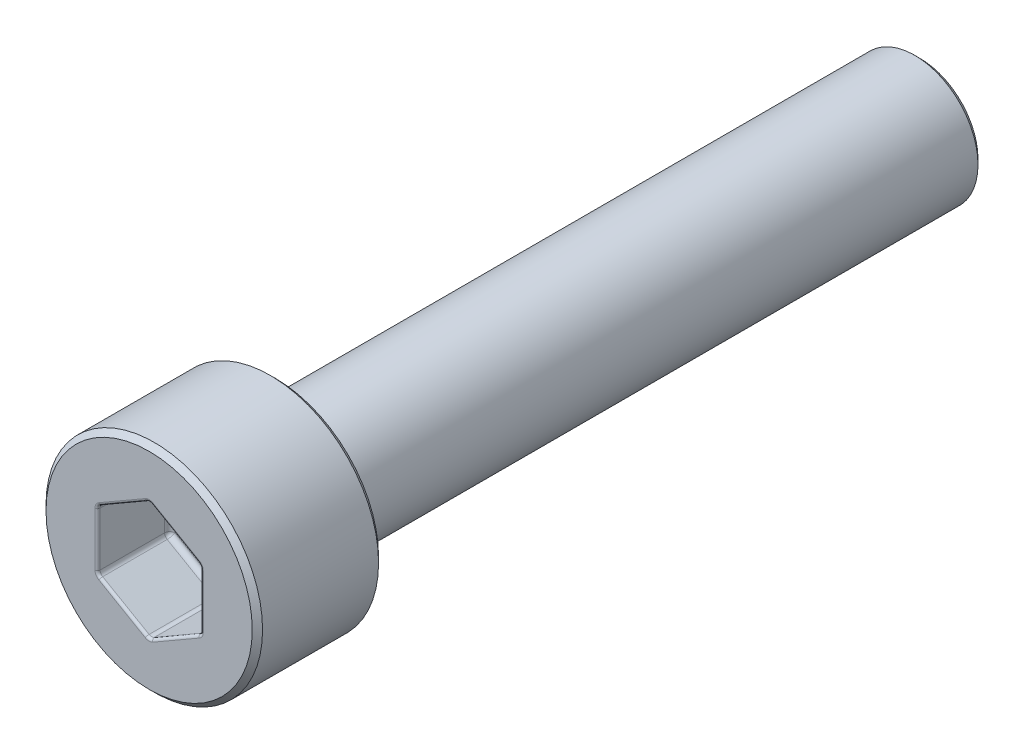
from build123d import *

# Parameters (mm, degrees)
SCHNITT_LINEAR_AUSTRAGEN1_DEPTH = 2.8
FASE1_SIZE                      = 0.2
VERRUNDUNG1_R                   = 0.2
VERRUNDUNG2_R                   = 0.1


with BuildPart() as part:
    # Skizze1 → Rotation1 (revolve)
    with BuildSketch(Plane(origin=(0, 0, 0), x_dir=(0, 0, -1), z_dir=(1, 0, 0))):
        Polygon((-4.9, 0), (-4.9, 4.2), (0, 4.2), (0, 2.45), (25, 2.45), (25, 0), align=None)
    revolve(axis=Axis((0, 0, 21.919879518), (0, 0, -1)))

    # Skizze2 → Schnitt-Linear austragen1 (cut)
    with BuildSketch(Plane.XY.offset(4.9)):
        Polygon((2, -1.154700538), (2, 1.154700538), (0, 2.309401077), (-2, 1.154700538), (-2, -1.154700538), (0, -2.309401077), align=None)
    extrude(amount=-SCHNITT_LINEAR_AUSTRAGEN1_DEPTH, mode=Mode.SUBTRACT)

    # Fase1
    fase1_edges = [part.edges().sort_by_distance(p)[0] for p in [
        (0, -4.2, 4.9),
        (0, -4.2, 0),
        (0, -2.45, -25),
    ]]
    chamfer(fase1_edges, length=FASE1_SIZE)

    # Verrundung1
    verrundung1_edges = [part.edges().sort_by_distance(p)[0] for p in [
        (-1, -1.732050808, 2.1),
        (-2, 0, 2.1),
        (-1, 1.732050808, 2.1),
        (1, 1.732050808, 2.1),
        (2, 0, 2.1),
        (1, -1.732050808, 2.1),
        (-2, -1.154700538, 3.5),
        (0, -2.309401077, 3.5),
        (2, -1.154700538, 3.5),
        (2, 1.154700538, 3.5),
        (0, 2.309401077, 3.5),
        (-2, 1.154700538, 3.5),
        (0, -2.45, 0),
    ]]
    fillet(verrundung1_edges, radius=VERRUNDUNG1_R)

    # Verrundung2
    verrundung2_edges = [part.edges().sort_by_distance(p)[0] for p in [
        (1.973205081, -1.139230485, 4.9),
        (1, -1.732050808, 4.9),
        (0, -2.278460969, 4.9),
        (-1, -1.732050808, 4.9),
        (-1.973205081, -1.139230485, 4.9),
        (-2, 0, 4.9),
        (-1.973205081, 1.139230485, 4.9),
        (-1, 1.732050808, 4.9),
        (0, 2.278460969, 4.9),
        (1, 1.732050808, 4.9),
        (1.973205081, 1.139230485, 4.9),
        (2, 0, 4.9),
    ]]
    fillet(verrundung2_edges, radius=VERRUNDUNG2_R)


solid = part.part
